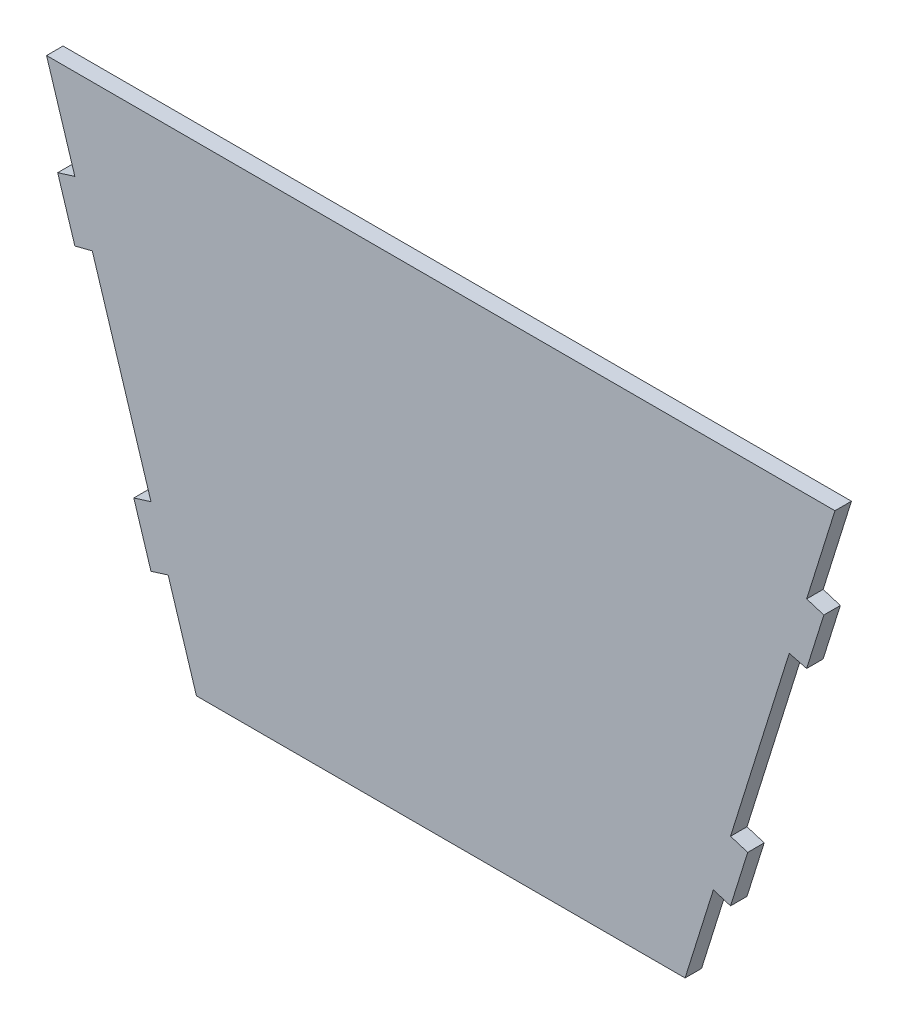
from build123d import *

# Parameters (mm, degrees)
BOSS_EXTRUDE1_DEPTH = 2.75


with BuildPart() as part:
    # Sketch2 → Boss-Extrude1 (new body)
    with BuildSketch(Plane.XY):
        Polygon((-40.75, 0), (40.75, 0), (45.46875, 15.1), (48.332189934, 14.205175021), (51.195629868, 23.36818281), (48.332189934, 24.263007789), (58.123068817, 55.593820214), (61.027668644, 54.843287174), (63.894689934, 64.005175021), (61.03125, 64.9), (65.75, 80), (-65.75, 80), (-61.03125, 64.9), (-63.894689934, 64.005175021), (-61.027668644, 54.843287174), (-58.123068817, 55.593820214), (-48.332189934, 24.263007789), (-51.195629868, 23.36818281), (-48.332189934, 14.205175021), (-45.46875, 15.1), align=None)
    extrude(amount=BOSS_EXTRUDE1_DEPTH)


solid = part.part
